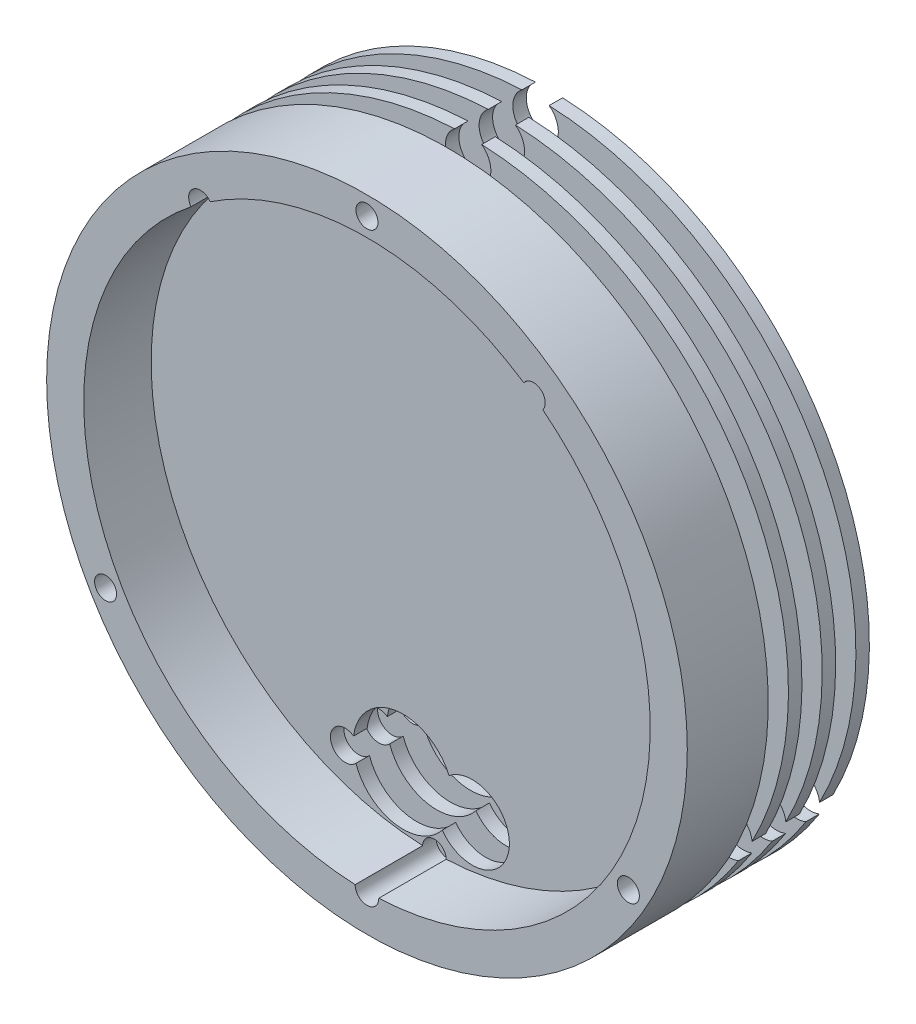
from build123d import *

# Parameters (mm, degrees)
SKETCH1_R                                           = 47.5
SKETCH1_R_2                                         = 42
BOSS_EXTRUDE1_DEPTH                                 = 10
BOSS_EXTRUDE2_START                                 = 20
SKETCH4_R                                           = 47.5
BOSS_EXTRUDE2_DEPTH                                 = 20
SKETCH5_R                                           = 47.5
SKETCH5_R_2                                         = 26
CUT_EXTRUDE1_DEPTH                                  = 3
LPATTERN1_COUNT                                     = 4
LPATTERN1_PITCH                                     = 5
CBORE_FOR_4_BINDING_HEAD_MACHINE_SCREW3_D           = 3.2639
CBORE_FOR_4_BINDING_HEAD_MACHINE_SCREW3_CBORE_D     = 6.74624
CBORE_FOR_4_BINDING_HEAD_MACHINE_SCREW3_CBORE_DEPTH = 14.4272
CIRPATTERN2_COUNT                                   = 3
SKETCH16_R                                          = 1.75
CUT_EXTRUDE2_DEPTH                                  = 12
CIRPATTERN3_COUNT                                   = 5
SKETCH21_R                                          = 6
CUT_EXTRUDE5_DEPTH                                  = 20
SKETCH22_R                                          = 7.4
CUT_EXTRUDE6_DEPTH                                  = 22
SKETCH23_R                                          = 5.5
CUT_EXTRUDE7_DEPTH                                  = 22
SKETCH24_R                                          = 2.2
CUT_EXTRUDE8_DEPTH                                  = 22


with BuildPart() as part:
    # Sketch1 → Boss-Extrude1 (new body)
    with BuildSketch(Plane.XY):
        Circle(SKETCH1_R)
        Circle(SKETCH1_R_2, mode=Mode.SUBTRACT)
    extrude(amount=BOSS_EXTRUDE1_DEPTH)

    # Sketch4 → Boss-Extrude2 (add)
    with BuildSketch(Plane(origin=(0, 0, 0), x_dir=(-1, 0, 0), z_dir=(0, 0, -1)).offset(BOSS_EXTRUDE2_START)):
        Circle(SKETCH4_R)
    extrude(amount=-BOSS_EXTRUDE2_DEPTH)

    # Sketch5 → Cut-Extrude1 (cut)
    with BuildSketch(Plane(origin=(0, 0, -20), x_dir=(-1, 0, 0), z_dir=(0, 0, -1))):
        Circle(SKETCH5_R)
        Circle(SKETCH5_R_2, mode=Mode.SUBTRACT)
    cut_extrude1 = extrude(amount=-CUT_EXTRUDE1_DEPTH, mode=Mode.SUBTRACT)

    # LPattern1: Cut-Extrude1 ×4
    with Locations(*[(0, 0, i * LPATTERN1_PITCH) for i in range(1, LPATTERN1_COUNT)]):
        add(cut_extrude1, mode=Mode.SUBTRACT)

    # CBORE for #4 Binding Head Machine Screw3 (through all)
    with Locations(Plane(origin=(0, 0, -17), x_dir=(-1, 0, 0), z_dir=(0, 0, -1))):
        with Locations((0, 44.75)):
            cbore_for_4_binding_head_machine_screw3 = CounterBoreHole(CBORE_FOR_4_BINDING_HEAD_MACHINE_SCREW3_D / 2, CBORE_FOR_4_BINDING_HEAD_MACHINE_SCREW3_CBORE_D / 2, CBORE_FOR_4_BINDING_HEAD_MACHINE_SCREW3_CBORE_DEPTH)

    # CirPattern2: CBORE for #4 Binding Head Machine Screw3 ×3 about axis
    cirpattern2_axis = Axis((0, 0, 0), (0, 0, 1))
    for i in range(1, CIRPATTERN2_COUNT):
        add(cbore_for_4_binding_head_machine_screw3.rotate(cirpattern2_axis, i * 360 / CIRPATTERN2_COUNT), mode=Mode.SUBTRACT)

    # Sketch16 → Cut-Extrude2 (cut)
    with BuildSketch(Plane.XY.offset(10)):
        with Locations((0, -42)):
            Circle(SKETCH16_R)
    cut_extrude2 = extrude(amount=-CUT_EXTRUDE2_DEPTH, mode=Mode.SUBTRACT)

    # CirPattern3: Cut-Extrude2 ×5 about axis, 2 skipped
    cirpattern3_axis = Axis((0, 0, 10), (0, 0, -1))
    add([cut_extrude2.rotate(cirpattern3_axis, i * 360 / CIRPATTERN3_COUNT) for i in range(1, CIRPATTERN3_COUNT) if i not in (1, 4)], mode=Mode.SUBTRACT)

    # Sketch21 → Cut-Extrude5 (cut)
    with BuildSketch(Plane(origin=(0, 0, -20), x_dir=(-1, 0, 0), z_dir=(0, 0, -1))):
        with Locations((-13.43425834, 32.776896042)):
            Circle(SKETCH21_R)
    extrude(amount=-CUT_EXTRUDE5_DEPTH, mode=Mode.SUBTRACT)

    # Sketch22 → Cut-Extrude6 (cut)
    with BuildSketch(Plane(origin=(0, 0, -20), x_dir=(-1, 0, 0), z_dir=(0, 0, -1))):
        with Locations((4.637001489, -33.917803127)):
            Circle(SKETCH22_R)
    extrude(amount=-CUT_EXTRUDE6_DEPTH, mode=Mode.SUBTRACT)

    # Sketch23 → Cut-Extrude7 (cut)
    with BuildSketch(Plane(origin=(0, 0, -20), x_dir=(-1, 0, 0), z_dir=(0, 0, -1))):
        with Locations((-5.614995734, -35.295003963)):
            Circle(SKETCH23_R)
    extrude(amount=-CUT_EXTRUDE7_DEPTH, mode=Mode.SUBTRACT)

    # Sketch24 → Cut-Extrude8 (cut)
    with BuildSketch(Plane(origin=(0, 0, -20), x_dir=(-1, 0, 0), z_dir=(0, 0, -1))):
        with Locations((13.226831653, -34.820080994)):
            Circle(SKETCH24_R)
    extrude(amount=-CUT_EXTRUDE8_DEPTH, mode=Mode.SUBTRACT)


solid = part.part
